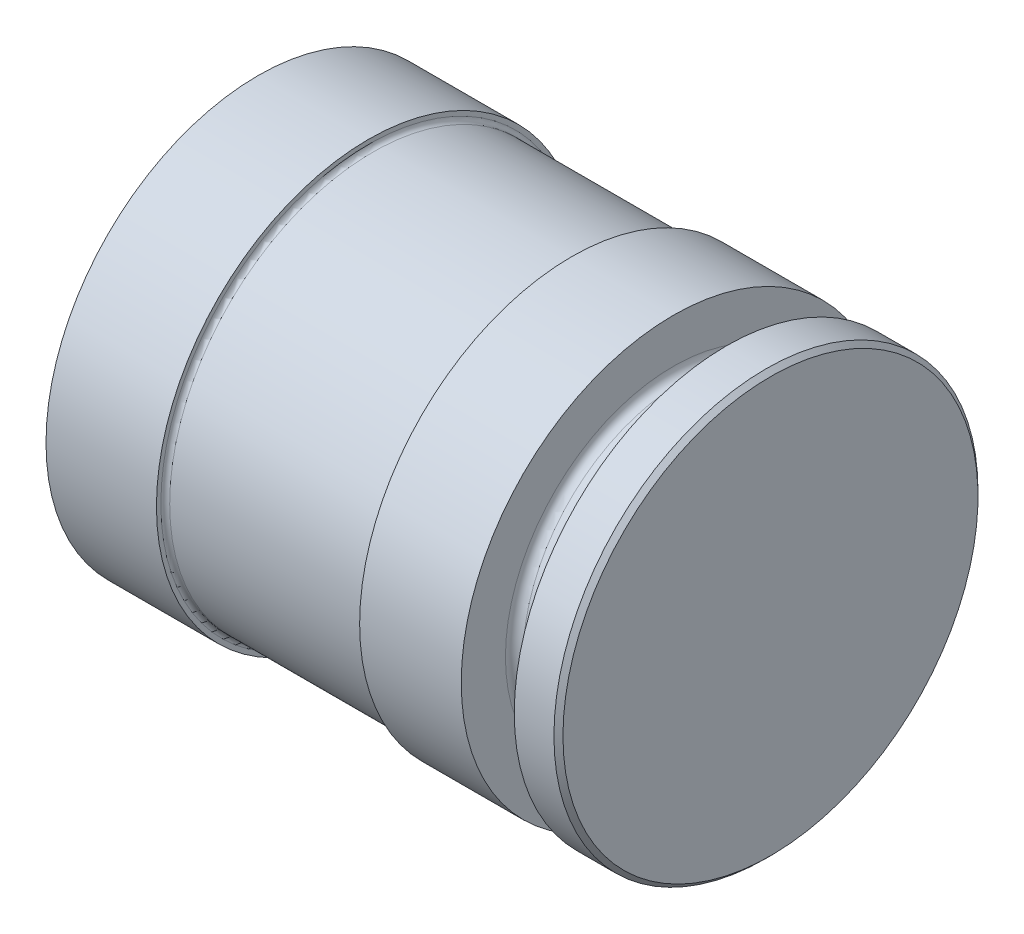
from build123d import *


with BuildPart() as part:
    # Esquisse1 → Révolution1 (revolve)
    with BuildSketch(Plane.XY):
        with BuildLine():
            Line((0, 0), (0, 10.267949192))
            Line((0, 10.267949192), (1, 12))
            Line((1, 12), (7.25, 12))
            Line((7.25, 12), (7.25, 11.75))
            ThreePointArc((7.25, 11.75), (7.323223305, 11.573223305), (7.5, 11.5))
            Line((7.5, 11.5), (18.5, 11.5))
            ThreePointArc((18.5, 11.5), (18.676776695, 11.573223305), (18.75, 11.75))
            Line((18.75, 11.75), (18.75, 12))
            Line((18.75, 12), (24.5, 12))
            Line((24.5, 12), (24.5, 9.5))
            ThreePointArc((24.5, 9.5), (24.646446609, 9.146446609), (25, 9))
            Line((25, 9), (27, 9))
            ThreePointArc((27, 9), (27.353553391, 9.146446609), (27.5, 9.5))
            Line((27.5, 9.5), (27.5, 12))
            Line((27.5, 12), (29.744406675, 12))
            Line((29.744406675, 12), (30, 11.744406675))
            Line((30, 11.744406675), (30, 0))
            Line((30, 0), (0, 0))
        make_face()
    revolve(axis=Axis((-20.325204918, 0, 0), (1, 0, 0)))


solid = part.part
